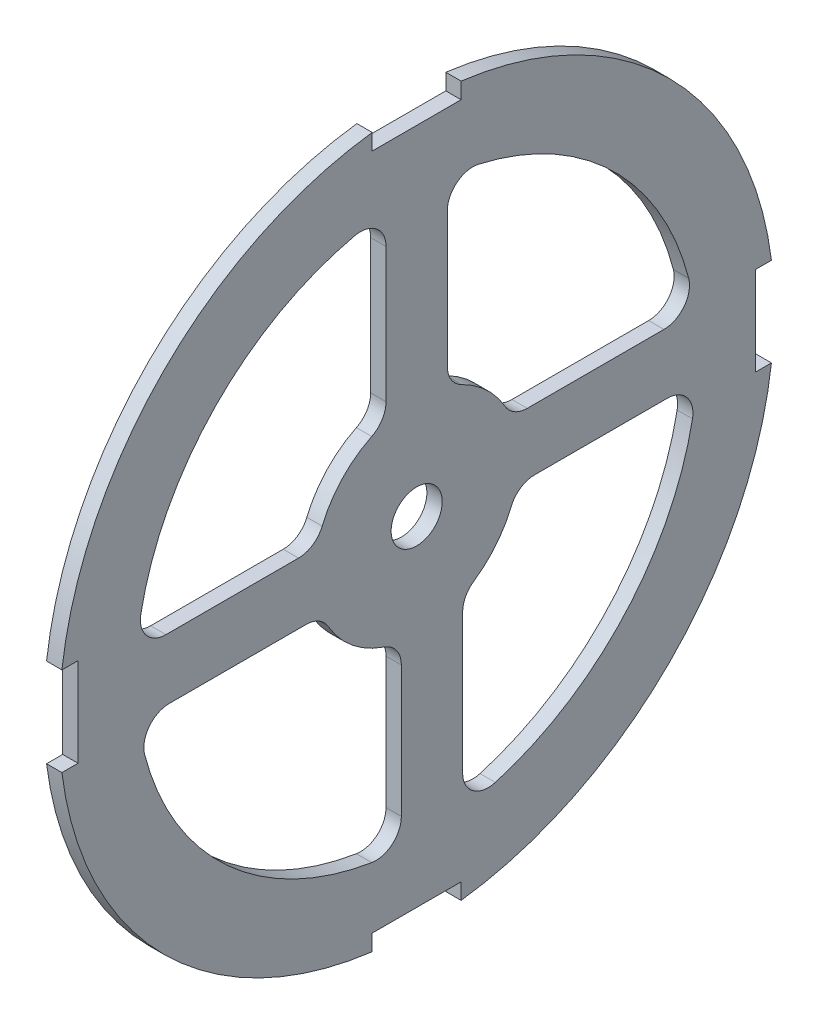
from build123d import *

# Parameters (mm, degrees)
SKETCH1_R           = 2.5
BOSS_EXTRUDE3_DEPTH = 1.5
FILLET1_R           = 2.5


with BuildPart() as part:
    # Sketch1 → Boss-Extrude3 (new body)
    with BuildSketch(Plane(origin=(0, 0, 0), x_dir=(0, 0, -1), z_dir=(1, 0, 0))):
        with BuildLine():
            Line((-34.72862652, 4.35), (-33.15, 4.35))
            Line((-33.15, 4.35), (-33.15, -4.35))
            Line((-33.15, -4.35), (-34.72862652, -4.35))
            ThreePointArc((-34.72862652, -4.35), (-24.748737342, -24.748737342), (-4.35, -34.72862652))
            Line((-4.35, -34.72862652), (-4.35, -33.15))
            Line((-4.35, -33.15), (4.35, -33.15))
            Line((4.35, -33.15), (4.35, -34.72862652))
            ThreePointArc((4.35, -34.72862652), (24.748737342, -24.748737342), (34.72862652, -4.35))
            Line((34.72862652, -4.35), (33.15, -4.35))
            Line((33.15, -4.35), (33.15, 4.35))
            Line((33.15, 4.35), (34.72862652, 4.35))
            ThreePointArc((34.72862652, 4.35), (24.748737342, 24.748737342), (4.35, 34.72862652))
            Line((4.35, 34.72862652), (4.35, 33.15))
            Line((4.35, 33.15), (-4.35, 33.15))
            Line((-4.35, 33.15), (-4.35, 34.72862652))
            ThreePointArc((-4.35, 34.72862652), (-24.748737342, 24.748737342), (-34.72862652, 4.35))
        make_face()
        Circle(SKETCH1_R, mode=Mode.SUBTRACT)
        with BuildLine():
            Line((9.270248109, 3.75), (27.243118397, 3.75))
            ThreePointArc((27.243118397, 3.75), (19.17641557, 19.71078603), (3, 27.335873866))
            Line((3, 27.335873866), (3, 9.539392014))
            ThreePointArc((3, 9.539392014), (6.783731432, 7.347175502), (9.270248109, 3.75))
        make_face(mode=Mode.SUBTRACT)
        with BuildLine():
            Line((-3, 9.539392014), (-3, 27.335873866))
            ThreePointArc((-3, 27.335873866), (-19.709993452, 19.177230199), (-27.407799985, 2.25))
            Line((-27.407799985, 2.25), (-9.743587635, 2.25))
            ThreePointArc((-9.743587635, 2.25), (-7.340542585, 6.790908228), (-3, 9.539392014))
        make_face(mode=Mode.SUBTRACT)
        with BuildLine():
            Line((9.743587635, -2.25), (27.407799985, -2.25))
            ThreePointArc((27.407799985, -2.25), (20.230473673, -18.627343744), (4.5, -27.129319933))
            Line((4.5, -27.129319933), (4.5, -8.93028555))
            ThreePointArc((4.5, -8.93028555), (7.866161766, -6.174422974), (9.743587635, -2.25))
        make_face(mode=Mode.SUBTRACT)
        with BuildLine():
            Line((-1.5, -9.886859967), (-1.5, -27.459060435))
            ThreePointArc((-1.5, -27.459060435), (-18.629857769, -20.22815858), (-27.243118397, -3.75))
            Line((-27.243118397, -3.75), (-9.270248109, -3.75))
            ThreePointArc((-9.270248109, -3.75), (-6.197969316, -7.847622338), (-1.5, -9.886859967))
        make_face(mode=Mode.SUBTRACT)
    extrude(amount=BOSS_EXTRUDE3_DEPTH)

    # Fillet1
    fillet1_edges = [part.edges().sort_by_distance(p)[0] for p in [
        (0.75, -9.886859967, 1.5),
        (0.75, -3.75, 9.270248109),
        (0.75, -3.75, 27.243118397),
        (0.75, -27.459060435, 1.5),
        (0.75, 27.335873866, 3),
        (0.75, 2.25, 27.407799985),
        (0.75, 2.25, 9.743587635),
        (0.75, 9.539392014, 3),
        (0.75, 3.75, -27.243118397),
        (0.75, 27.335873866, -3),
        (0.75, 9.539392014, -3),
        (0.75, 3.75, -9.270248109),
        (0.75, -2.25, -9.743587635),
        (0.75, -8.93028555, -4.5),
        (0.75, -27.129319933, -4.5),
        (0.75, -2.25, -27.407799985),
    ]]
    fillet(fillet1_edges, radius=FILLET1_R)


solid = part.part
